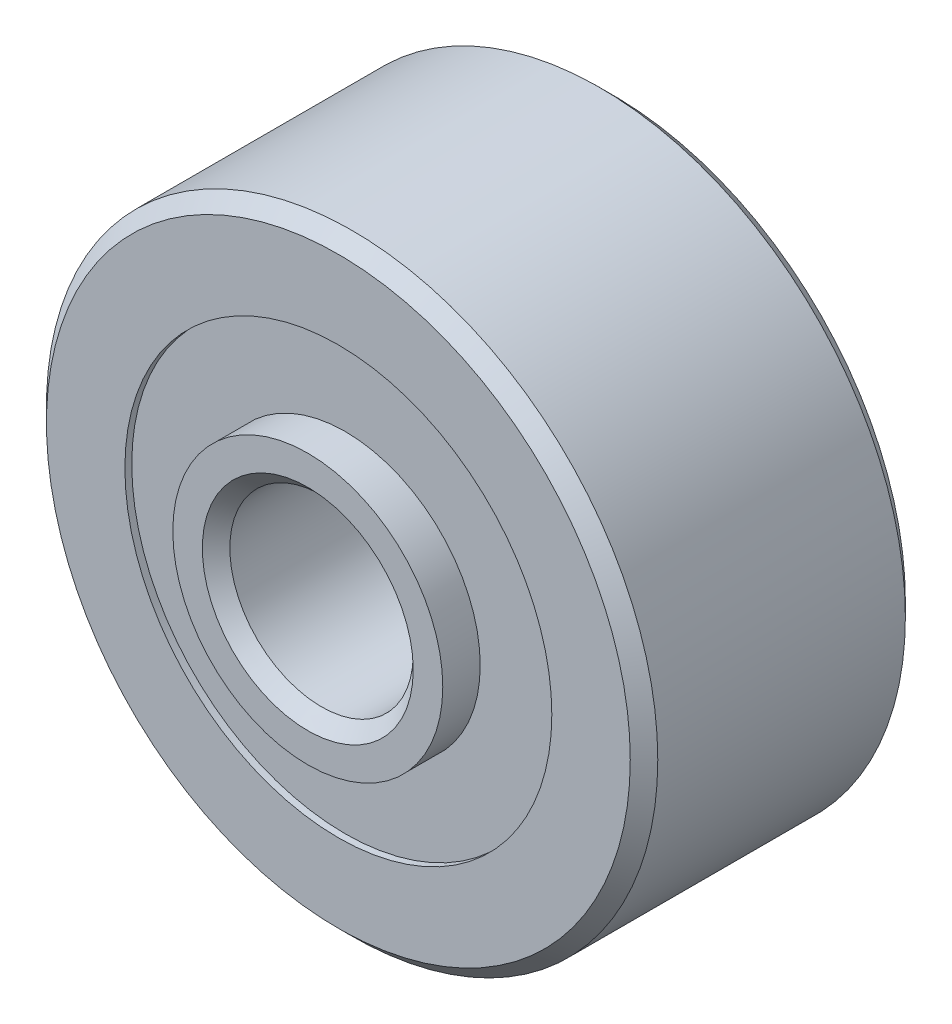
from build123d import *

# Parameters (mm, degrees)
CIRPATTERN1_COUNT = 8
SKETCH5_W         = 0.880023833
SKETCH5_H         = 1.018983104


with BuildPart() as part:
    # Sketch1 → Revolve1 (revolve)
    with BuildSketch(Plane(origin=(0, 0, 0), x_dir=(0, 0, -1), z_dir=(1, 0, 0)), mode=Mode.PRIVATE) as revolve1_sk:
        with BuildLine():
            Line((1.60734375, 3.96875), (-1.60734375, 3.96875))
            Line((-1.60734375, 3.96875), (-1.7859375, 3.79015625))
            Line((-1.7859375, 3.79015625), (-1.7859375, 2.771583104))
            Line((-1.7859375, 2.771583104), (-0.79375, 2.771583104))
            ThreePointArc((-0.79375, 2.771583104), (0, 3.396304292), (0.79375, 2.771583104))
            Line((0.79375, 2.771583104), (1.7859375, 2.771583104))
            Line((1.7859375, 2.771583104), (1.7859375, 3.79015625))
            Line((1.7859375, 3.79015625), (1.60734375, 3.96875))
        make_face()
    revolve(revolve1_sk.sketch.rotate(Axis((0, 0, 1.7859375), (0, 0, -1)), 90), axis=Axis((0, 0, 1.7859375), (0, 0, -1)))


with BuildPart() as body_2:
    # Sketch3 → Revolve3 (revolve)
    with BuildSketch(Plane(origin=(0, 0, 0), x_dir=(0, 0, -1), z_dir=(1, 0, 0)), mode=Mode.PRIVATE) as revolve3_sk:
        Polygon((-2.1828125, 1.36921875), (-2.1828125, 1.7526), (2.1828125, 1.7526), (2.1828125, 1.36921875), (2.00421875, 1.190625), (-2.00421875, 1.190625), align=None)
    revolve(revolve3_sk.sketch.rotate(Axis((0, 0, 1.7859375), (0, 0, -1)), 90), axis=Axis((0, 0, 1.7859375), (0, 0, -1)))


with BuildPart() as body_3:
    # Sketch4 → Revolve4 (revolve)
    with BuildSketch(Plane(origin=(0, 0, 0), x_dir=(0, 0, -1), z_dir=(1, 0, 0))):
        with BuildLine():
            Line((-0.816616792, 2.5796875), (0.816616792, 2.5796875))
            ThreePointArc((0.816616792, 2.5796875), (0, 3.396304292), (-0.816616792, 2.5796875))
        make_face()
    revolve(axis=Axis((0, 2.5796875, 0.816616792), (0, 0, -1)))


with BuildPart() as cirpattern1_1:
    # CirPattern1: pattern copy
    add(body_3.part.rotate(Axis((0, 0, 0), (0, 0, 1)), 1 * 360 / CIRPATTERN1_COUNT))


with BuildPart() as cirpattern1_2:
    # CirPattern1: pattern copy
    add(body_3.part.rotate(Axis((0, 0, 0), (0, 0, 1)), 2 * 360 / CIRPATTERN1_COUNT))


with BuildPart() as cirpattern1_3:
    # CirPattern1: pattern copy
    add(body_3.part.rotate(Axis((0, 0, 0), (0, 0, 1)), 3 * 360 / CIRPATTERN1_COUNT))


with BuildPart() as cirpattern1_4:
    # CirPattern1: pattern copy
    add(body_3.part.rotate(Axis((0, 0, 0), (0, 0, 1)), 4 * 360 / CIRPATTERN1_COUNT))


with BuildPart() as cirpattern1_5:
    # CirPattern1: pattern copy
    add(body_3.part.rotate(Axis((0, 0, 0), (0, 0, 1)), 5 * 360 / CIRPATTERN1_COUNT))


with BuildPart() as cirpattern1_6:
    # CirPattern1: pattern copy
    add(body_3.part.rotate(Axis((0, 0, 0), (0, 0, 1)), 6 * 360 / CIRPATTERN1_COUNT))


with BuildPart() as cirpattern1_7:
    # CirPattern1: pattern copy
    add(body_3.part.rotate(Axis((0, 0, 0), (0, 0, 1)), 7 * 360 / CIRPATTERN1_COUNT))


with BuildPart() as body_11:
    # Sketch5 → Revolve5 (revolve)
    with BuildSketch(Plane(origin=(0, 0, 0), x_dir=(0, 0, -1), z_dir=(1, 0, 0)), mode=Mode.PRIVATE) as revolve5_sk:
        with Locations((-1.256628709, 2.262091552)):
            Rectangle(SKETCH5_W, SKETCH5_H)
        with Locations((1.256628709, 2.262091552)):
            Rectangle(SKETCH5_W, SKETCH5_H)
    revolve(revolve5_sk.sketch.rotate(Axis((0, 0, 1.7859375), (0, 0, -1)), 90), axis=Axis((0, 0, 1.7859375), (0, 0, -1)))


solid = Compound([part.part, body_2.part, body_3.part, cirpattern1_1.part, cirpattern1_2.part, cirpattern1_3.part, cirpattern1_4.part, cirpattern1_5.part, cirpattern1_6.part, cirpattern1_7.part, body_11.part])
